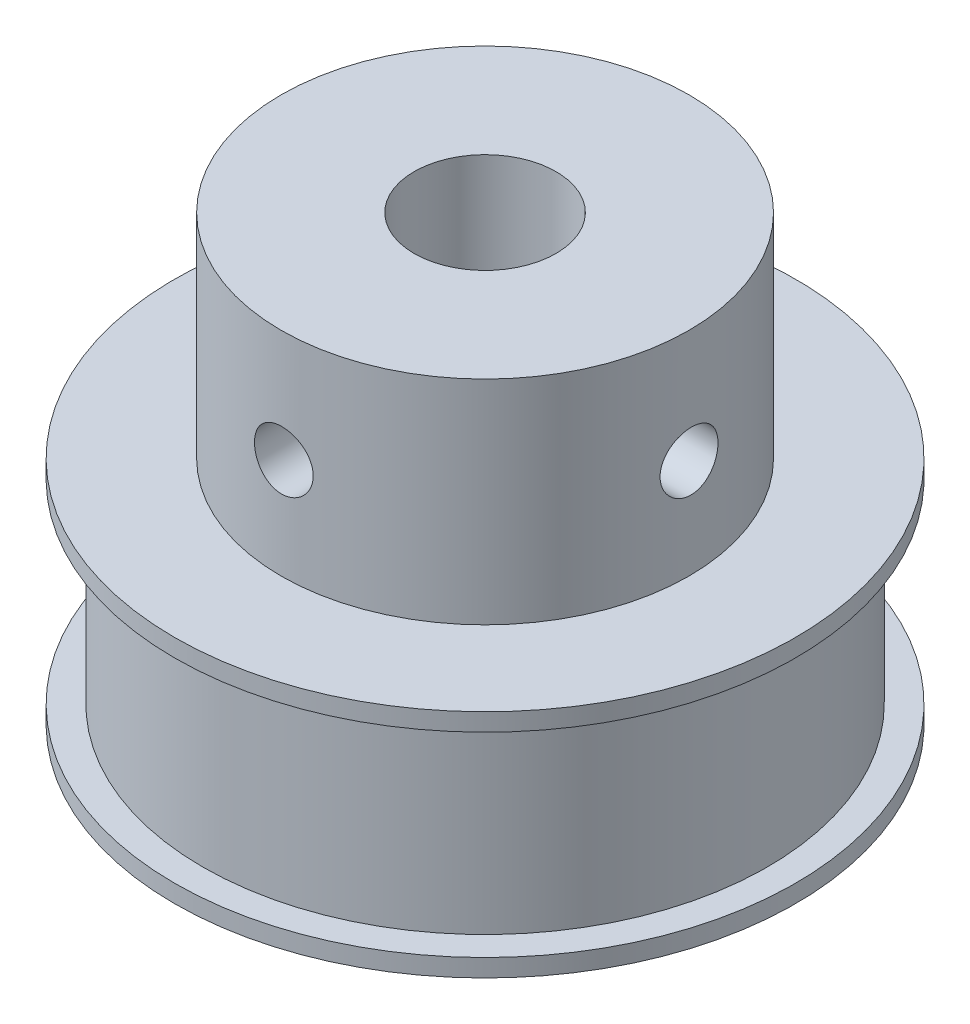
from build123d import *

# Parameters (mm, degrees)
SKETCH_1_R                       = 17.5
EXTRUDE_1_DEPTH                  = 1
SKETCH_2_R                       = 15.915
EXTRUDE_2_DEPTH                  = 11
SKETCH_3_R                       = 17.5
EXTRUDE_3_DEPTH                  = 1
SKETCH_4_R                       = 11.5
EXTRUDE_4_DEPTH                  = 12
SKETCH_5_R                       = 4
CUT_EXTRUDE_1_DEPTH              = 36.178118199
HOLE_WIZARD_M4_1_REACH           = 40.674
HOLE_WIZARD_M4_1_BORE_R          = 1.65
HOLE_WIZARD_M4_1_ON_FACE_2_REACH = 40.693
HOLE_WIZARD_M4_1_BORE_2_R        = 1.65


with BuildPart() as part:
    # 草图1 → 凸台-拉伸1 (new body)
    with BuildSketch(Plane(origin=(0, 0, 0), x_dir=(1, 0, 0), z_dir=(0, 1, 0))):
        with Locations(Location((0, 0, 0), (0, 0, 270))):
            Circle(SKETCH_1_R)
    extrude(amount=EXTRUDE_1_DEPTH)

    # 草图2 → 凸台-拉伸2 (add)
    with BuildSketch(Plane(origin=(0, 1, 0), x_dir=(1, 0, 0), z_dir=(0, 1, 0))):
        with Locations(Location((0, 0, 0), (0, 0, 270))):
            Circle(SKETCH_2_R)
    extrude(amount=EXTRUDE_2_DEPTH)

    # 草图3 → 凸台-拉伸3 (add)
    with BuildSketch(Plane(origin=(0, 12, 0), x_dir=(1, 0, 0), z_dir=(0, 1, 0))):
        with Locations(Location((0, 0, 0), (0, 0, 270))):
            Circle(SKETCH_3_R)
    extrude(amount=EXTRUDE_3_DEPTH)

    # 草图4 → 凸台-拉伸4 (add)
    with BuildSketch(Plane(origin=(0, 13, 0), x_dir=(1, 0, 0), z_dir=(0, 1, 0))):
        with Locations(Location((0, 0, 0), (0, 0, 270))):
            Circle(SKETCH_4_R)
    extrude(amount=EXTRUDE_4_DEPTH)

    # 草图5 → 切除-拉伸1 (cut, through all)
    with BuildSketch(Plane(origin=(0, 25, 0), x_dir=(1, 0, 0), z_dir=(0, 1, 0))):
        with Locations(Location((0, 0, 0), (0, 0, 270))):
            Circle(SKETCH_5_R)
    extrude(amount=-CUT_EXTRUDE_1_DEPTH, mode=Mode.SUBTRACT)

    # M4 螺纹孔1 bore (on position points) → M4 螺纹孔1 (cut, up to next)
    with BuildSketch(Plane(origin=(11.499382171, 18.555582634, -0.119204379), x_dir=(0.010365598164, 0, 0.999946275744), z_dir=(0.999946275744, 0, -0.010365598164)), mode=Mode.PRIVATE) as hole_wizard_m4_1_sk1:
        Circle(HOLE_WIZARD_M4_1_BORE_R)
    hole_wizard_m4_1_tool1 = extrude(hole_wizard_m4_1_sk1.sketch, amount=-HOLE_WIZARD_M4_1_REACH, mode=Mode.PRIVATE) & part.part
    add(hole_wizard_m4_1_tool1.solids().sort_by_distance((11.499382, 18.555583, -0.119204))[0], mode=Mode.SUBTRACT)

    # M4 螺纹孔1 bore 2 (on position points) → M4 螺纹孔1 on face 2 (cut, up to next)
    with BuildSketch(Plane(origin=(0.03684499, 18.671535984, 11.499940976), x_dir=(0.99999486718, 0, -0.003203999574), z_dir=(0.003203999574, 0, 0.99999486718)), mode=Mode.PRIVATE) as hole_wizard_m4_1_on_face_2_sk1:
        Circle(HOLE_WIZARD_M4_1_BORE_2_R)
    hole_wizard_m4_1_on_face_2_tool1 = extrude(hole_wizard_m4_1_on_face_2_sk1.sketch, amount=-HOLE_WIZARD_M4_1_ON_FACE_2_REACH, mode=Mode.PRIVATE) & part.part
    add(hole_wizard_m4_1_on_face_2_tool1.solids().sort_by_distance((0.036845, 18.671536, 11.499941))[0], mode=Mode.SUBTRACT)


solid = part.part
